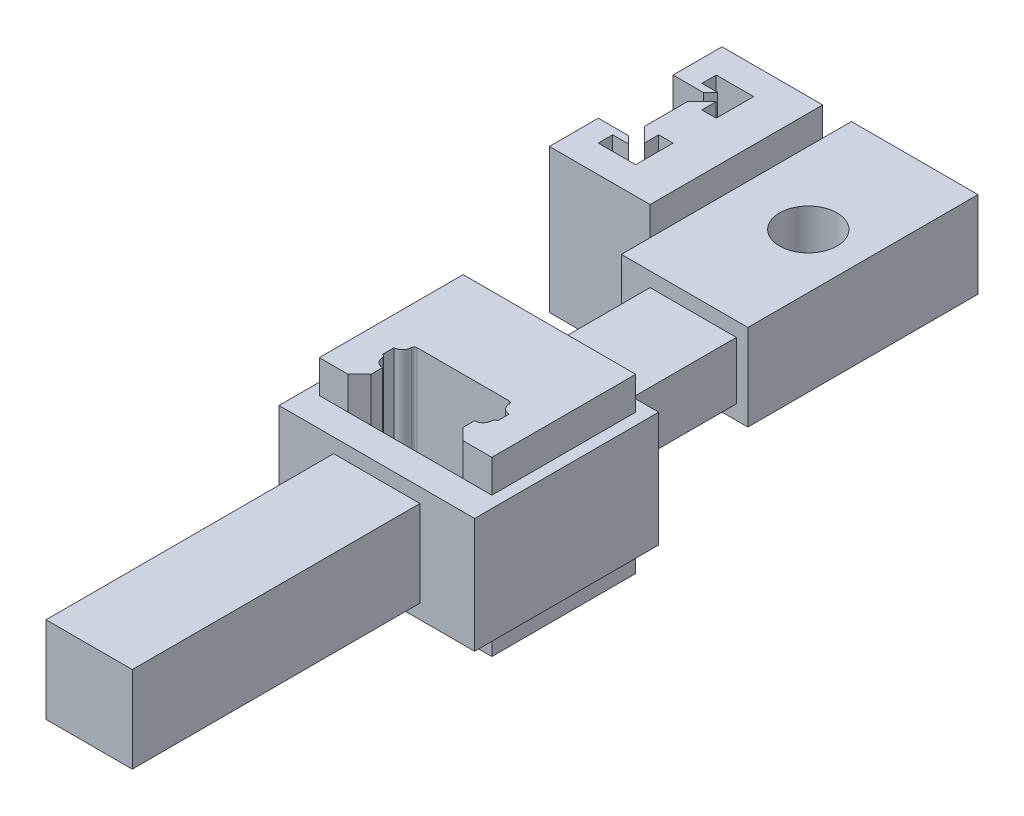
from build123d import *

# Parameters (mm, degrees)
SKETCH3_W                = 30
SKETCH3_H                = 25
BASETOPPLANE_DEPTH       = 30
BOSS_EXTRUDE1_DEPTH      = 5
BOSS_EXTRUDE1_DEPTH_BACK = 27
SKETCH6_W                = 34
SKETCH6_H                = 20
CUT_EXTRUDE1_DEPTH       = 39.668462602
SKETCH7_W                = 15
SKETCH7_H                = 10
BACKBAR_DEPTH            = 60
SIDECONNECT_DEPTH        = 5
SIDECONNECT_DEPTH_BACK   = 17
SKETCH8_W                = 40
SKETCH8_H                = 15
SKETCH9_W                = 30
SKETCH9_H                = 25
SIDESLIDER_DEPTH         = 17.5
MOUNTINGCUT_DEPTH        = 88.316641384
DRILLFORMOVEMENT_D       = 10
SKETCH17_W               = 15
SKETCH17_H               = 15
FRONTBAR_DEPTH           = 50


with BuildPart() as part:
    # Sketch3 → baseTopPlane (new body)
    with BuildSketch(Plane(origin=(0, 0, 0), x_dir=(1, 0, 0), z_dir=(0, 1, 0))):
        Rectangle(SKETCH3_W, SKETCH3_H)
    extrude(amount=BASETOPPLANE_DEPTH)

    # Sketch6 → Boss-Extrude1 (add, two sides: drawn at the far end of the back side and taken through both)
    with BuildSketch(Plane.XY.offset(12.5).offset(-BOSS_EXTRUDE1_DEPTH_BACK)):
        with Locations((0, 14.294511799)):
            Rectangle(SKETCH6_W, SKETCH6_H)
    extrude(amount=BOSS_EXTRUDE1_DEPTH + BOSS_EXTRUDE1_DEPTH_BACK)

    # Sketch4 → Cut-Extrude1 (cut, through all)
    with BuildSketch(Plane(origin=(0, 30, 0), x_dir=(1, 0, 0), z_dir=(0, 1, 0))):
        with BuildLine():
            Line((0, -12.5), (10, -12.5))
            Line((10, -12.5), (8, -10.5))
            Line((8, -10.5), (8, -8.5))
            ThreePointArc((8, -8.5), (9.060660172, -8.060660172), (9.5, -7))
            ThreePointArc((9.5, -7), (9.646446609, -6.646446609), (10, -6.5))
            Line((10, -6.5), (10, -4.5))
            ThreePointArc((10, -4.5), (8.939339828, -4.060660172), (8.5, -3))
            ThreePointArc((8.5, -3), (8.353553391, -2.646446609), (8, -2.5))
            Line((8, -2.5), (0, -2.5))
            Line((0, -2.5), (0, -12.5))
        make_face()
    cut_extrude1 = extrude(amount=-CUT_EXTRUDE1_DEPTH, mode=Mode.SUBTRACT)

    # Mirror1: Cut-Extrude1 across plane
    add(cut_extrude1.mirror(Plane(origin=(0, 0, 2.5), x_dir=(0, 0, 1), z_dir=(-1, 0, 0))), mode=Mode.SUBTRACT)

    # Sketch7 → BackBar (add)
    with BuildSketch(Plane(origin=(0, 0, -14.5), x_dir=(-1, 0, 0), z_dir=(0, 0, -1))):
        with Locations((0, 14.294511799)):
            Rectangle(SKETCH7_W, SKETCH7_H)
    extrude(amount=BACKBAR_DEPTH)

    # Sketch8 → sideConnect (add, two sides: drawn at the far end of the back side and taken through both)
    with BuildSketch(Plane.ZY.offset(7.5).offset(-SIDECONNECT_DEPTH_BACK)):
        with Locations((-57.5, 14.294511799)):
            Rectangle(SKETCH8_W, SKETCH8_H)
    extrude(amount=SIDECONNECT_DEPTH + SIDECONNECT_DEPTH_BACK)

    # Sketch9 → sideSlider (add)
    with BuildSketch(Plane.ZY.offset(12.5)):
        with Locations((-57.5, 14.294511799)):
            Rectangle(SKETCH9_W, SKETCH9_H)
    extrude(amount=SIDESLIDER_DEPTH)

    # Sketch13 → mountingCut (cut, through all)
    with BuildSketch(Plane(origin=(0, 26.794511799, 0), x_dir=(1, 0, 0), z_dir=(0, 1, 0))):
        Polygon((-30, 64), (-30, 51), (-24.75, 51), (-23.5, 49.75), (-26.25, 49.75), (-26.25, 47.25), (-19.75, 47.25), (-19.75, 53.75), (-22.25, 53.75), (-22.25, 51.25), (-24.75, 53.75), (-24.75, 61.25), (-22.25, 63.75), (-22.25, 61.25), (-19.75, 61.25), (-19.75, 67.75), (-26.25, 67.75), (-26.25, 65.25), (-23.5, 65.25), (-24.75, 64), align=None)
    extrude(amount=-MOUNTINGCUT_DEPTH, mode=Mode.SUBTRACT)

    # DrillforMovement (through all)
    with Locations(Plane(origin=(0, 21.794511799, 0), x_dir=(1, 0, 0), z_dir=(0, 1, 0))):
        with Locations((0, 57.5)):
            Hole(DRILLFORMOVEMENT_D / 2)

    # Sketch17 → frontBar (add)
    with BuildSketch(Plane.XY.offset(17.5)):
        with Locations((0, 14.294511799)):
            Rectangle(SKETCH17_W, SKETCH17_H)
    extrude(amount=FRONTBAR_DEPTH)


solid = part.part
